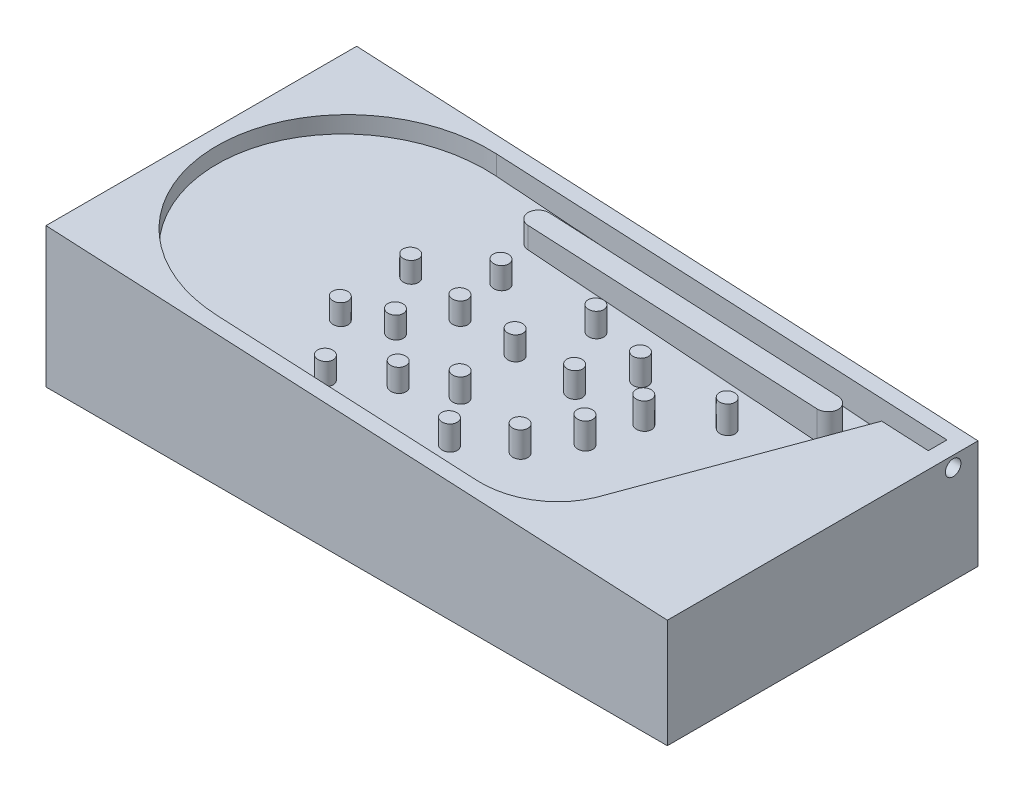
from build123d import *

# Parameters (mm, degrees)
EXTRUDE_1_DEPTH      = 20
CUT_EXTRUDE_START    = 20
SKETCH_4_R           = 0.5
CUT_EXTRUDE_6_DEPTH  = 15
EXTRUDE_2_DEPTH      = 10
EXTRUDE_3_DEPTH      = 20
CUT_EXTRUDE_7_DEPTH  = 20
SKETCH_12_R          = 0.5
CUT_EXTRUDE_10_DEPTH = 20
CUT_EXTRUDE_15_DEPTH = 20
SKETCH_15_R          = 0.5
CUT_EXTRUDE_16_DEPTH = 1


with BuildPart() as part:
    # 草圖2 → 填料-伸長1 (new body)
    with BuildSketch(Plane.XY):
        Polygon((0, 0), (0, 20), (40, 15), (40, 0), align=None)
    extrude(amount=EXTRUDE_1_DEPTH)

    # 草圖4 → 除料-伸長6 (cut)
    with BuildSketch(Plane(origin=(1.235539726, 0, 0), x_dir=(1, 0, 0), z_dir=(0, 1, 0)).offset(CUT_EXTRUDE_START)):
        with BuildLine():
            Line((8.764460274, -1), (37.764460274, -1))
            Line((37.764460274, -1), (37.764460274, -19))
            Line((37.764460274, -19), (8.764460274, -19))
            ThreePointArc((8.764460274, -19), (-0.235539726, -10), (8.764460274, -1))
        make_face()
        with Locations((14.484350187, -6.426353647)):
            Circle(SKETCH_4_R, mode=Mode.SUBTRACT)
        with Locations((13.880099762, -12.615834701)):
            Circle(SKETCH_4_R, mode=Mode.SUBTRACT)
        with Locations((18.597641111, -9.629824046)):
            Circle(SKETCH_4_R, mode=Mode.SUBTRACT)
        with Locations((23.67865621, -6.642424392)):
            Circle(SKETCH_4_R, mode=Mode.SUBTRACT)
        with Locations((23.798217352, -14.512669522)):
            Circle(SKETCH_4_R, mode=Mode.SUBTRACT)
        with Locations((19.146558444, -13.71910453)):
            Circle(SKETCH_4_R, mode=Mode.SUBTRACT)
        with Locations((22.321317197, -9.525445181)):
            Circle(SKETCH_4_R, mode=Mode.SUBTRACT)
        with Locations((26.052750908, -8.803862679)):
            Circle(SKETCH_4_R, mode=Mode.SUBTRACT)
        with Locations((25.314084108, -11.850948182)):
            Circle(SKETCH_4_R, mode=Mode.SUBTRACT)
        with Locations((28.771173887, -6.151414905)):
            Circle(SKETCH_4_R, mode=Mode.SUBTRACT)
        with Locations((19.819687009, -5.651663075)):
            Circle(SKETCH_4_R, mode=Mode.SUBTRACT)
        with Locations((11.444186287, -9.199481051)):
            Circle(SKETCH_4_R, mode=Mode.SUBTRACT)
        with Locations((11.529073964, -13.817559785)):
            Circle(SKETCH_4_R, mode=Mode.SUBTRACT)
        with Locations((14.193117081, -17.441077825)):
            Circle(SKETCH_4_R, mode=Mode.SUBTRACT)
        with Locations((16.733650127, -15.295531213)):
            Circle(SKETCH_4_R, mode=Mode.SUBTRACT)
        with Locations((21.311821949, -16.574794778)):
            Circle(SKETCH_4_R, mode=Mode.SUBTRACT)
        with Locations((15.10499253, -9.689628951)):
            Circle(SKETCH_4_R, mode=Mode.SUBTRACT)
        with BuildLine():
            Line((13.53826807, -2.349817412), (32.116451532, -2.349817412))
            ThreePointArc((32.116451532, -2.349817412), (32.806890875, -3.040256756), (32.116451532, -3.730696099))
            Line((32.116451532, -3.730696099), (13.53826807, -3.730696099))
            ThreePointArc((13.53826807, -3.730696099), (12.847828727, -3.040256756), (13.53826807, -2.349817412))
        make_face(mode=Mode.SUBTRACT)
    extrude(amount=-CUT_EXTRUDE_6_DEPTH, mode=Mode.SUBTRACT)

    # 草圖4<5> → 填料-伸長2 (add)
    with BuildSketch(Plane(origin=(1.235539726, 0, 0), x_dir=(1, 0, 0), z_dir=(0, 1, 0))):
        with BuildLine():
            Line((37.764460274, -19), (37.764460274, -2.2))
            Line((37.764460274, -2.2), (34.764460274, -2.2))
            Line((34.764460274, -2.2), (30.053349233, -15.898079159))
            ThreePointArc((30.053349233, -15.898079159), (28.25547142, -18.150801067), (25.501205312, -19))
            Line((25.501205312, -19), (37.764460274, -19))
        make_face()
    extrude(amount=EXTRUDE_2_DEPTH)

    # 草圖9 → 填料-伸長3 (add)
    with BuildSketch(Plane.XY.offset(20)):
        Polygon((0, 0), (40, 0), (40, 5), (0, 8), align=None)
    extrude(amount=-EXTRUDE_3_DEPTH)

    # 草圖11 → 除料-伸長7 (cut)
    with BuildSketch(Plane.XY.offset(20)):
        Polygon((0, 20), (0, 10), (40, 10), (40, 15), align=None)
    extrude(amount=-CUT_EXTRUDE_7_DEPTH, mode=Mode.SUBTRACT)

    # 草圖12 → 除料-伸長10 (cut)
    with BuildSketch(Plane(origin=(40, 0, 0), x_dir=(0, 0, -1), z_dir=(1, 0, 0))):
        with Locations((-1.6, 9)):
            Circle(SKETCH_12_R)
    extrude(amount=-CUT_EXTRUDE_10_DEPTH, mode=Mode.SUBTRACT)

    # 草圖14 → 除料-伸長15 (cut)
    with BuildSketch(Plane.XY.offset(20)):
        Polygon((40, 10), (0, 10), (0, 9), (40, 7), align=None)
    extrude(amount=-CUT_EXTRUDE_15_DEPTH, mode=Mode.SUBTRACT)

    # 草圖15 → 除料-伸長16 (cut)
    with BuildSketch(Plane(origin=(40, 0, 0), x_dir=(0, 0, -1), z_dir=(1, 0, 0))):
        with Locations((-1.6, 6.3)):
            Circle(SKETCH_15_R)
    extrude(amount=-CUT_EXTRUDE_16_DEPTH, mode=Mode.SUBTRACT)


solid = part.part
